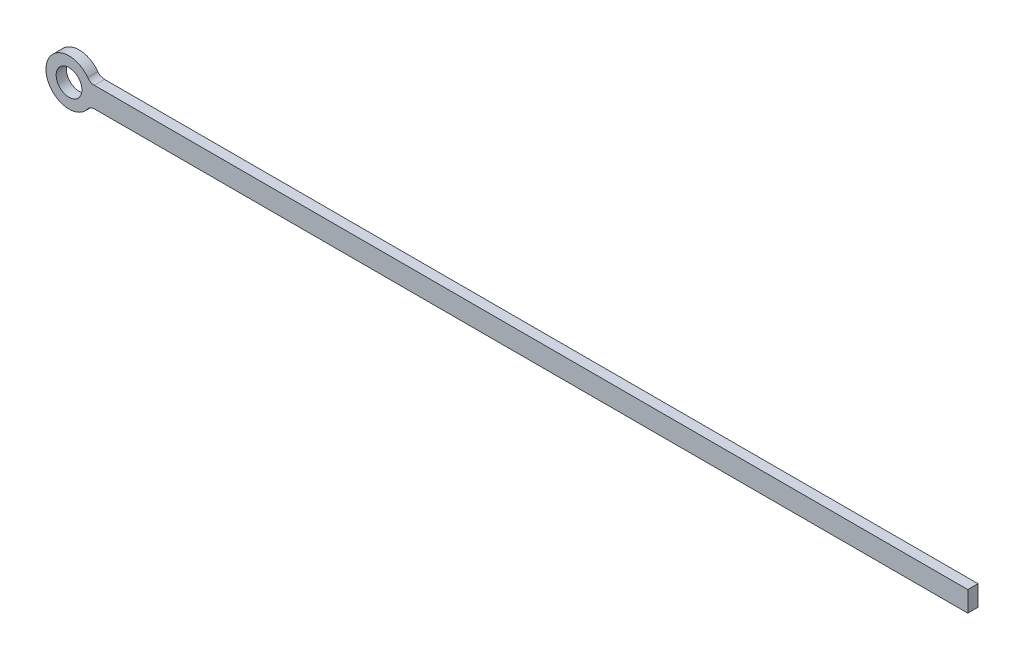
from build123d import *

# Parameters (mm, degrees)
SKETCH1_R           = 4
BOSS_EXTRUDE1_DEPTH = 3.175


with BuildPart() as part:
    # Sketch1 → Boss-Extrude1 (new body)
    with BuildSketch(Plane.XY):
        with BuildLine():
            Line((7.856207737, 3.175), (279.4, 3.175))
            Line((279.4, 3.175), (279.4, -3.175))
            Line((279.4, -3.175), (7.856207737, -3.175))
            ThreePointArc((7.856207737, -3.175), (6.703743885, -3.451501144), (5.802191509, -4.220805455))
            ThreePointArc((5.802191509, -4.220805455), (-7.175, 0), (5.802191509, 4.220805455))
            ThreePointArc((5.802191509, 4.220805455), (6.703743885, 3.451501144), (7.856207737, 3.175))
        make_face()
        Circle(SKETCH1_R, mode=Mode.SUBTRACT)
    extrude(amount=BOSS_EXTRUDE1_DEPTH)


solid = part.part
